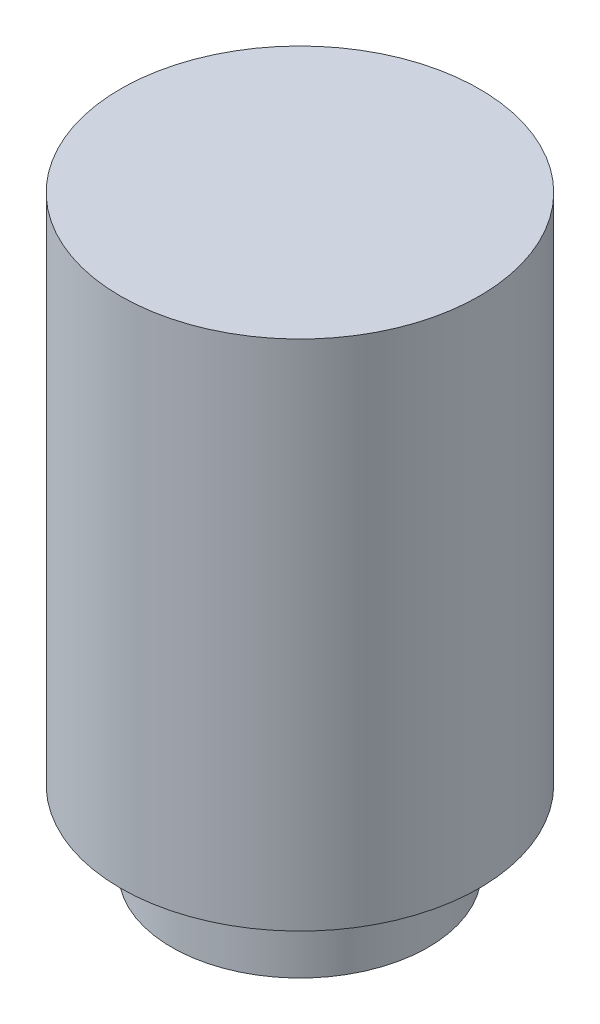
from build123d import *

# Parameters (mm, degrees)
SKETCH2_R           = 70
BOSS_EXTRUDE1_DEPTH = 200
SKETCH3_R           = 50
BOSS_EXTRUDE2_DEPTH = 30
SKETCH4_R           = 30
BOSS_EXTRUDE3_DEPTH = 10


with BuildPart() as part:
    # Sketch2 → Boss-Extrude1 (new body)
    with BuildSketch(Plane(origin=(0, 0, 0), x_dir=(1, 0, 0), z_dir=(0, 1, 0))):
        with Locations(Location((0, 0, 0), (0, 0, 270))):
            Circle(SKETCH2_R)
    extrude(amount=BOSS_EXTRUDE1_DEPTH)

    # Sketch3 → Boss-Extrude2 (add)
    with BuildSketch(Plane.XZ):
        with Locations(Location((0, 0, 0), (0, 0, 270))):
            Circle(SKETCH3_R)
    extrude(amount=BOSS_EXTRUDE2_DEPTH)

    # Sketch4 → Boss-Extrude3 (add)
    with BuildSketch(Plane.XZ.offset(30)):
        with Locations(Location((0, 0, 0), (0, 0, 270))):
            Circle(SKETCH4_R)
    extrude(amount=BOSS_EXTRUDE3_DEPTH)


solid = part.part
